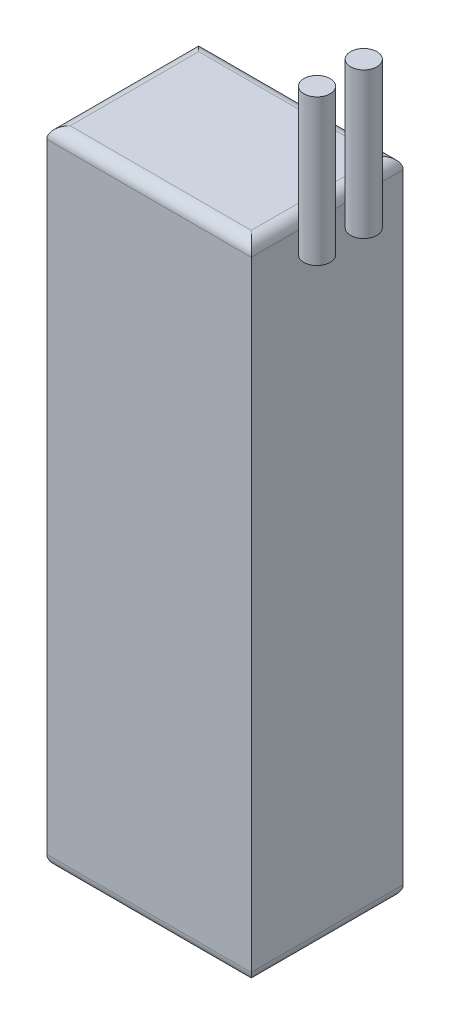
from build123d import *

# Parameters (mm, degrees)
SKETCH1_W                  = 35
SKETCH1_H                  = 26
BOSS_EXTRUDE1_DEPTH        = 110
BOSS_EXTRUDE2_DEPTH        = 20
BOSS_EXTRUDE2_DEPTH_BACK   = 5
SKETCH2_R                  = 2.25
BOSS_EXTRUDE2_2_DEPTH      = 20
BOSS_EXTRUDE2_2_DEPTH_BACK = 5
FILLET1_R                  = 2


with BuildPart() as part:
    # Sketch1 → Boss-Extrude1 (new body)
    with BuildSketch(Plane(origin=(0, 0, 0), x_dir=(1, 0, 0), z_dir=(0, 1, 0))):
        Rectangle(SKETCH1_W, SKETCH1_H)
    extrude(amount=BOSS_EXTRUDE1_DEPTH)

    # Fillet1
    fillet1_edges = [part.edges().sort_by_distance(p)[0] for p in [
        (-17.5, 110, 0),
        (0, 110, 13),
        (17.5, 110, 0),
        (0, 0, 13),
        (-17.5, 0, 0),
        (0, 0, -13),
        (17.5, 0, 0),
        (0, 110, -13),
    ]]
    fillet(fillet1_edges, radius=FILLET1_R)


with BuildPart() as body_2:
    # Sketch2 → Boss-Extrude2 (new, two sides: drawn at the far end of the back side and taken through both)
    with BuildSketch(Plane(origin=(0, 110, 0), x_dir=(1, 0, 0), z_dir=(0, 1, 0)).offset(-BOSS_EXTRUDE2_DEPTH_BACK)):
        with Locations(Location((19.75, 4, 0), (0, 0, 270))):
            Circle(SKETCH2_R)
    extrude(amount=BOSS_EXTRUDE2_DEPTH + BOSS_EXTRUDE2_DEPTH_BACK)


with BuildPart() as body_3:
    # Sketch2 → Boss-Extrude2 2 (new, two sides: drawn at the far end of the back side and taken through both)
    with BuildSketch(Plane(origin=(0, 110, 0), x_dir=(1, 0, 0), z_dir=(0, 1, 0)).offset(-BOSS_EXTRUDE2_2_DEPTH_BACK)):
        with Locations(Location((19.75, -4, 0), (0, 0, 90))):
            Circle(SKETCH2_R)
    extrude(amount=BOSS_EXTRUDE2_2_DEPTH + BOSS_EXTRUDE2_2_DEPTH_BACK)


solid = Compound([part.part, body_2.part, body_3.part])
